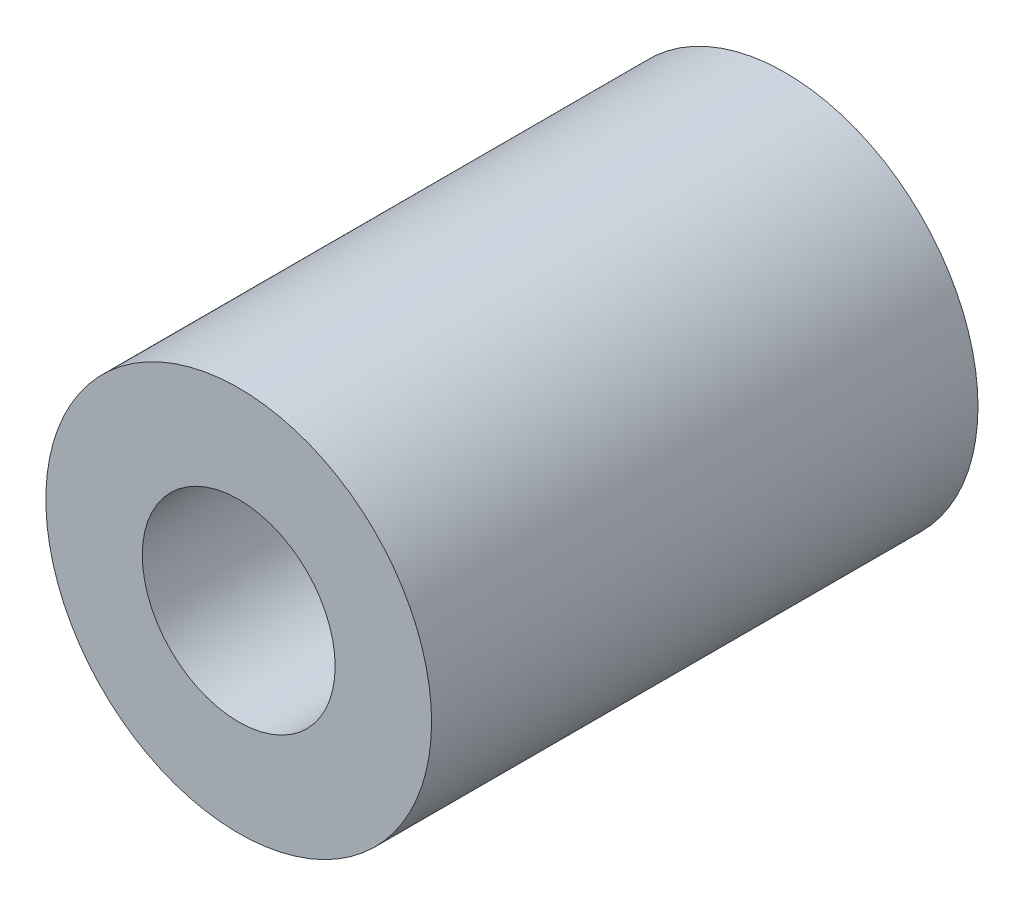
from build123d import *

# Parameters (mm, degrees)
SKETCH_1_R      = 6
SKETCH_1_R_2    = 3
EXTRUDE_1_DEPTH = 17


with BuildPart() as part:
    # 스케치1 → 보스-돌출1 (new body)
    with BuildSketch(Plane.XY):
        Circle(SKETCH_1_R)
        Circle(SKETCH_1_R_2, mode=Mode.SUBTRACT)
    extrude(amount=EXTRUDE_1_DEPTH)


solid = part.part
